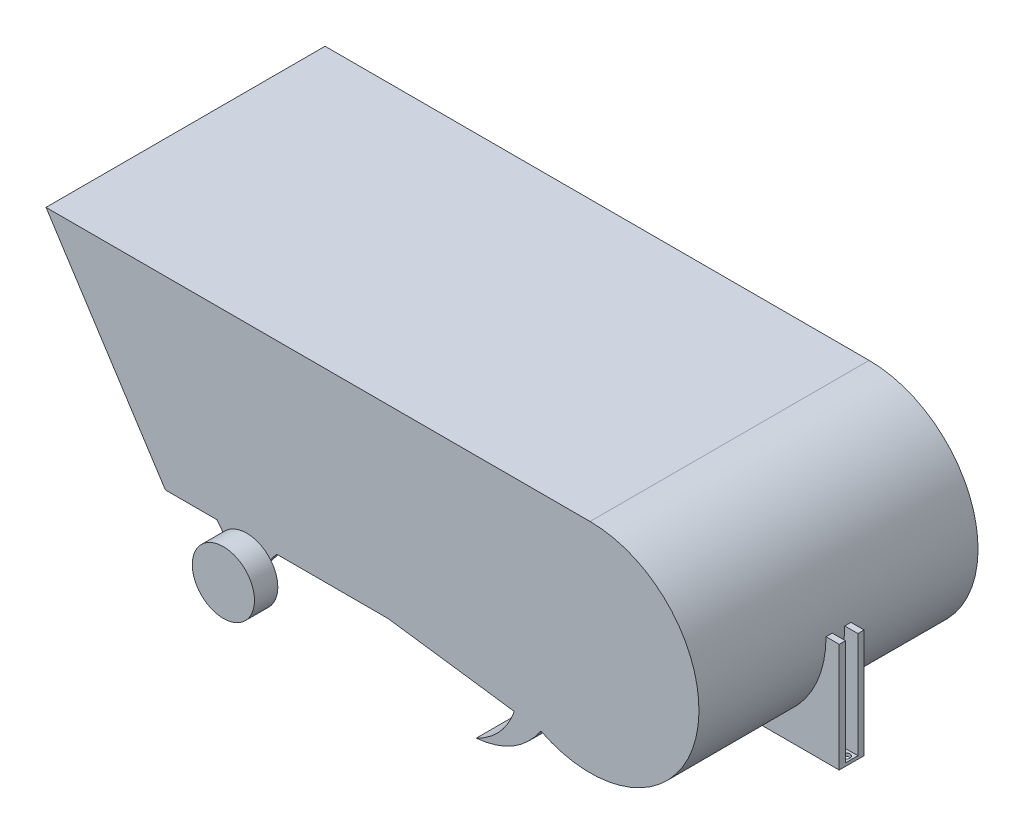
from build123d import *

# Parameters (mm, degrees)
BOSS_EXTRUDE1_DEPTH = 897
SKETCH2_R           = 10.767041916
BOSS_EXTRUDE2_DEPTH = 20
BOSS_EXTRUDE3_START = 20
BOSS_EXTRUDE3_DEPTH = 20
SKETCH4_W           = 50
SKETCH4_H           = 50
SKETCH4_R           = 12.5
BOSS_EXTRUDE4_DEPTH = 10
SKETCH5_R           = 100
BOSS_EXTRUDE5_DEPTH = 75
BOSS_EXTRUDE6_START = -75
BOSS_EXTRUDE6_DEPTH = 75


with BuildPart() as part:
    # Sketch1 → Boss-Extrude1 (new body)
    with BuildSketch(Plane.XY):
        with BuildLine():
            add(Edge.make_bspline(
                [(80.115553735, -191.384207833), (181.903017437, -142.41499007), (210.702960853, -28.558773965)],
                knots=[0, 0, 0, 1, 1, 1], degree=2))
            Line((210.702960853, -28.558773965), (401.206683232, -56.895630445))
            ThreePointArc((401.206683232, -56.895630445), (750.24986995, 222.286833017), (446.080798211, 549.785184001))
            Line((446.080798211, 549.785184001), (-1220.08310634, 549.785184001))
            Line((-1220.08310634, 549.785184001), (-894.475187417, 45))
            Line((-894.475187417, 45), (-374.993230006, 45))
            Line((-374.993230006, 45), (160.769466444, 352.592623287))
            ThreePointArc((160.769466444, 352.592623287), (141.659115875, 226.01181659), (176.177724746, 102.738251846))
            ThreePointArc((176.177724746, 102.738251846), (-53.212296367, 196.881158582), (-203.945431646, 0))
            Line((-203.945431646, 0), (-918.997892597, 0))
            Line((-918.997892597, 0), (-1302.659640419, 594.785184001))
            Line((-1302.659640419, 594.785184001), (446.080798211, 594.785184001))
            ThreePointArc((446.080798211, 594.785184001), (786.541848074, 163.629324532), (288.192746113, -67.578967279))
            add(Edge.make_bspline(
                [(80.115553735, -191.384207833), (212.051449387, -178.806537551), (288.192746113, -67.578967279)],
                knots=[0, 0, 0, 1, 1, 1], degree=2))
        make_face()
    extrude(amount=BOSS_EXTRUDE1_DEPTH)

    # Sketch2 → Boss-Extrude2 (add)
    with BuildSketch(Plane.XY.offset(897)):
        Polygon((-753.618518266, 0), (-561.471662121, 0), (-657.545090194, -121.801839924), align=None)
        with Locations((-657.545090194, -89.507472225)):
            Circle(SKETCH2_R, mode=Mode.SUBTRACT)
        with BuildLine():
            Line((-712.370379676, -20), (-602.719800711, -20))
            Line((-602.719800711, -20), (-641.587482876, -69.276426335))
            ThreePointArc((-641.587482876, -69.276426335), (-657.545090194, -63.740430309), (-673.502697511, -69.276426335))
            Line((-673.502697511, -69.276426335), (-712.370379676, -20))
        make_face(mode=Mode.SUBTRACT)
    boss_extrude2 = extrude(amount=-BOSS_EXTRUDE2_DEPTH)

    # Mirror1: Boss-Extrude2 across plane
    add(boss_extrude2.mirror(Plane.XY.offset(448.5)))

    # Sketch3 → Boss-Extrude3 (add)
    with BuildSketch(Plane.XY.offset(448.5).offset(BOSS_EXTRUDE3_START)):
        with BuildLine():
            Line((796.080798211, -105.214815999), (446.080798211, -105.214815999))
            ThreePointArc((446.080798211, -105.214815999), (693.568171626, -2.702189415), (796.080798211, 244.785184001))
            Line((796.080798211, 244.785184001), (838.444150781, 244.785184001))
            Line((838.444150781, 244.785184001), (838.444150781, -105.214815999))
            Line((838.444150781, -105.214815999), (796.080798211, -105.214815999))
        make_face()
    extrude(amount=BOSS_EXTRUDE3_DEPTH)

    # Mirror2: part across plane


with BuildPart() as part_1:
    add(part.part)
    add(part.part.mirror(Plane.XY.offset(448.5)))

    # Sketch4 → Boss-Extrude4 (add)
    with BuildSketch(Plane.XZ.offset(105.214815999)):
        with Locations((813.444150781, 448.5)):
            Rectangle(SKETCH4_W, SKETCH4_H)
        with Locations((820.168886717, 448.5)):
            Circle(SKETCH4_R, mode=Mode.SUBTRACT)
    extrude(amount=-BOSS_EXTRUDE4_DEPTH)

    # Sketch5 → Boss-Extrude5 (add)
    with BuildSketch(Plane.XY.offset(897)):
        with Locations(Location((-657.545090194, -89.507472225, 0), (0, 0, 139.802215435))):
            Circle(SKETCH5_R)
    extrude(amount=BOSS_EXTRUDE5_DEPTH)

    # Mirror3: part across plane


with BuildPart() as part_2:
    add(part_1.part)
    add(part_1.part.mirror(Plane.XY.offset(448.5)))

    # Sketch6 → Boss-Extrude6 (add)
    with BuildSketch(Plane.XY.offset(897).offset(BOSS_EXTRUDE6_START)):
        with BuildLine():
            Line((-203.945431646, 0), (-561.471662121, 0))
            Line((-561.471662121, 0), (-753.618518266, 0))
            Line((-753.618518266, 0), (-918.997892597, 0))
            Line((-918.997892597, 0), (-1302.659640419, 594.785184001))
            Line((-1302.659640419, 594.785184001), (446.080798211, 594.785184001))
            ThreePointArc((446.080798211, 594.785184001), (786.541848074, 163.629324532), (288.192746113, -67.578967279))
            Line((288.192746113, -67.578967279), (-203.945431646, 0))
        make_face()
    extrude(amount=BOSS_EXTRUDE6_DEPTH)


solid = part_2.part
